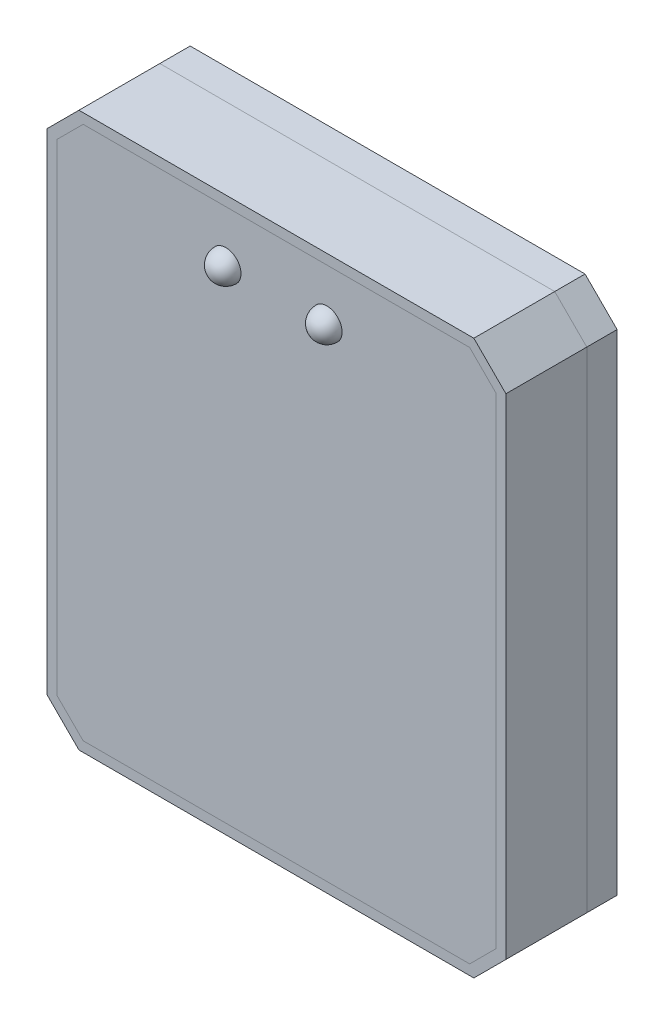
from build123d import *

# Parameters (mm, degrees)
BOSS_EXTRUDE1_DEPTH     = 1.7
SKETCH2_R               = 1.95
BOSS_EXTRUDE2_DEPTH     = 0.8
SKETCH4_R               = 1.5
BOSS_EXTRUDE3_DEPTH     = 4.5
FILLET1_R               = 1.5
BOSS_EXTRUDE4_DEPTH     = 5
BOSS_EXTRUDE5_DEPTH     = 3
SKETCH8_R               = 1.2
BOSS_EXTRUDE6_DEPTH     = 3
MIRROR2_COPY_1_SKETCH_R = 1.2
MIRROR2_COPY_1_DEPTH    = 3
SKETCH9_R               = 1.5
FRONT_DEPTH             = 3
SKETCH10_R              = 1.6
BACK_DEPTH              = 3


with BuildPart() as part:
    # Sketch1 → Boss-Extrude1 (new body)
    with BuildSketch(Plane.XY):
        Polygon((-18.5, 21.6), (-20.5, 19.6), (-20.5, -19.6), (-18.5, -21.6), (18.5, -21.6), (20.5, -19.6), (20.5, 19.6), (18.5, 21.6), align=None)
    extrude(amount=-BOSS_EXTRUDE1_DEPTH)


with BuildPart() as body_2:
    # Sketch2 → Boss-Extrude2 (new body)
    with BuildSketch(Plane.XY):
        with Locations((-5, 25)):
            Circle(SKETCH2_R)
    extrude(amount=-BOSS_EXTRUDE2_DEPTH)

    # Sketch4 → Boss-Extrude3 (add)
    with BuildSketch(Plane.XY):
        with Locations((-5, 25)):
            Circle(SKETCH4_R)
    extrude(amount=BOSS_EXTRUDE3_DEPTH)

    # Fillet1
    fillet1_edges = [body_2.edges().sort_by_distance(p)[0] for p in [
        (-6.5, 25, 4.5),
    ]]
    fillet(fillet1_edges, radius=FILLET1_R)


with BuildPart() as body_3:
    # LED green: mirrored copy
    add(body_2.part.mirror(Plane(origin=(0, 0, 0), x_dir=(0, 0, 1), z_dir=(1, 0, 0))))


with BuildPart() as body_4:
    # Sketch6 → Boss-Extrude4 (new body)
    with BuildSketch(Plane.XY):
        Polygon((-19.528427125, 31), (19.528427125, 31), (22.7, 27.828427125), (22.7, -20.628427125), (19.528427125, -23.8), (-19.528427125, -23.8), (-22.7, -20.628427125), (-22.7, 27.828427125), align=None)
        Polygon((-18.7, -21.8), (18.7, -21.8), (20.7, -19.8), (20.7, 27), (18.7, 29), (-18.7, 29), (-20.7, 27), (-20.7, -19.8), align=None, mode=Mode.SUBTRACT)
    extrude(amount=-BOSS_EXTRUDE4_DEPTH)

    # Sketch7 → Boss-Extrude5 (add)
    with BuildSketch(Plane.XY):
        Polygon((22.7, 27.828427125), (19.528427125, 31), (-19.528427125, 31), (-22.7, 27.828427125), (-22.7, -20.628427125), (-19.528427125, -23.8), (19.528427125, -23.8), (22.7, -20.628427125), align=None)
        Polygon((21.7, 27.414213562), (19.114213562, 30), (-19.114213562, 30), (-21.7, 27.414213562), (-21.7, -20.214213562), (-19.114213562, -22.8), (19.114213562, -22.8), (21.7, -20.214213562), align=None, mode=Mode.SUBTRACT)
    extrude(amount=BOSS_EXTRUDE5_DEPTH)

    # Sketch8 → Boss-Extrude6 (add)
    with BuildSketch(Plane(origin=(0, 0, -5), x_dir=(-1, 0, 0), z_dir=(0, 0, -1))):
        with BuildLine():
            Line((-14.7, 29), (-18.7, 29))
            Line((-18.7, 29), (-20.7, 27))
            Line((-20.7, 27), (-20.7, 23))
            Line((-20.7, 23), (-17.7, 23))
            ThreePointArc((-17.7, 23), (-15.578679656, 23.878679656), (-14.7, 26))
            Line((-14.7, 26), (-14.7, 29))
        make_face()
        with Locations((-17.7, 26)):
            Circle(SKETCH8_R, mode=Mode.SUBTRACT)
    boss_extrude6 = extrude(amount=-BOSS_EXTRUDE6_DEPTH)

    # Mirror1: Boss-Extrude6 across plane
    add(boss_extrude6.mirror(Plane(origin=(0, 0, 0), x_dir=(0, 0, 1), z_dir=(1, 0, 0))))

    # Mirror2: Boss-Extrude6 across plane
    add(boss_extrude6.mirror(Plane.ZX.offset(3.6)))

    # Mirror2 copy 1 sketch → Mirror2 copy 1 (add)
    with BuildSketch(Plane(origin=(0, 7.2, -5), x_dir=(1, 0, 0), z_dir=(0, 0, -1))):
        with BuildLine():
            Line((-14.7, 29), (-18.7, 29))
            Line((-18.7, 29), (-20.7, 27))
            Line((-20.7, 27), (-20.7, 23))
            Line((-20.7, 23), (-17.7, 23))
            ThreePointArc((-17.7, 23), (-15.578679656, 23.878679656), (-14.7, 26))
            Line((-14.7, 26), (-14.7, 29))
        make_face()
        with Locations((-17.7, 26)):
            Circle(MIRROR2_COPY_1_SKETCH_R, mode=Mode.SUBTRACT)
    extrude(amount=-MIRROR2_COPY_1_DEPTH)


with BuildPart() as body_5:
    # Sketch9 → Front (new body)
    with BuildSketch(Plane.XY):
        Polygon((-21.7, 27.414213562), (-19.114213562, 30), (19.114213562, 30), (21.7, 27.414213562), (21.7, -20.214213562), (19.114213562, -22.8), (-19.114213562, -22.8), (-21.7, -20.214213562), align=None)
        with Locations((-5, 25)):
            Circle(SKETCH9_R, mode=Mode.SUBTRACT)
        with Locations((5, 25)):
            Circle(SKETCH9_R, mode=Mode.SUBTRACT)
    extrude(amount=FRONT_DEPTH)


with BuildPart() as body_6:
    # Sketch10 → Back (new body)
    with BuildSketch(Plane(origin=(0, 0, -5), x_dir=(-1, 0, 0), z_dir=(0, 0, -1))):
        Polygon((-22.7, 27.828427125), (-19.528427125, 31), (19.528427125, 31), (22.7, 27.828427125), (22.7, -20.628427125), (19.528427125, -23.8), (-19.528427125, -23.8), (-22.7, -20.628427125), align=None)
        with Locations((-17.7, 26)):
            Circle(SKETCH10_R, mode=Mode.SUBTRACT)
        with Locations((17.7, 26)):
            Circle(SKETCH10_R, mode=Mode.SUBTRACT)
        with Locations((17.7, -18.8)):
            Circle(SKETCH10_R, mode=Mode.SUBTRACT)
        with Locations((-17.7, -18.8)):
            Circle(SKETCH10_R, mode=Mode.SUBTRACT)
    extrude(amount=BACK_DEPTH)


solid = Compound([part.part, body_2.part, body_3.part, body_4.part, body_5.part, body_6.part])
